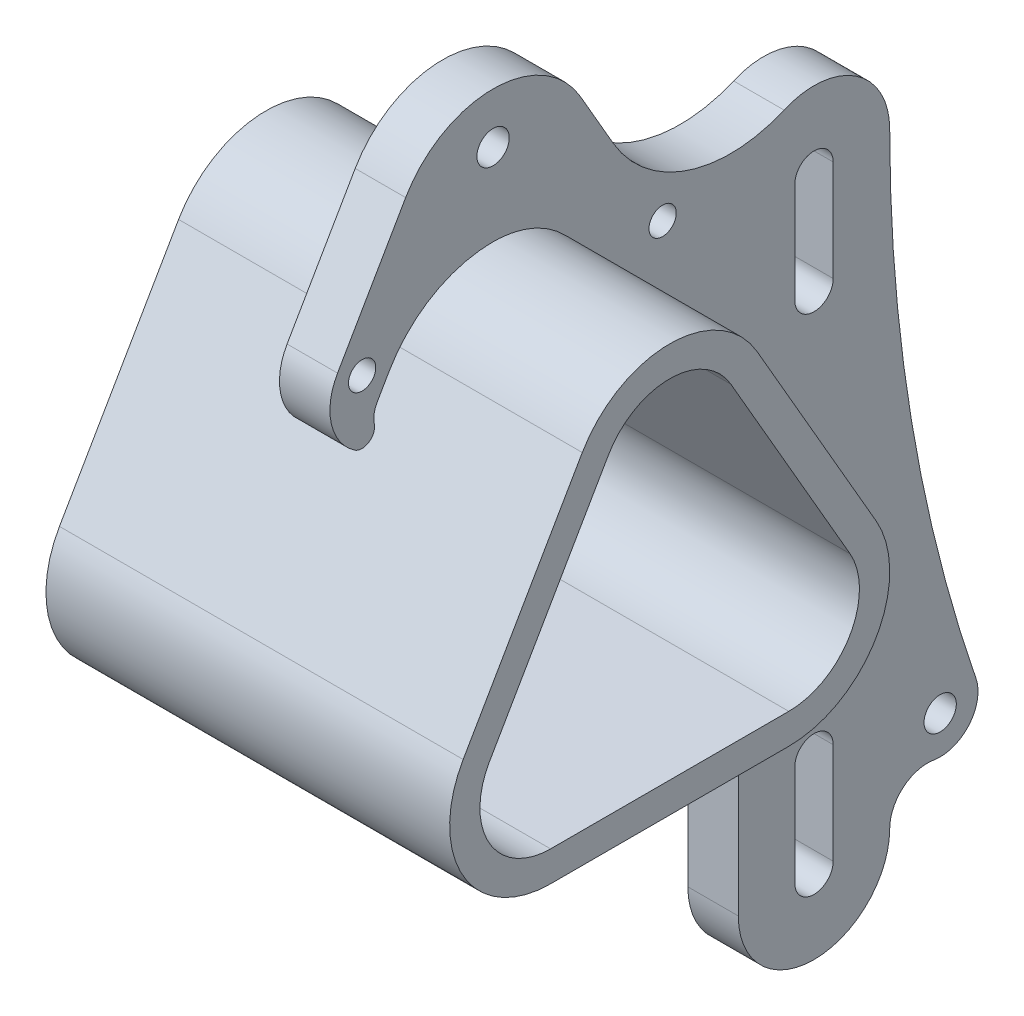
from build123d import *

# Parameters (mm, degrees)
BOSS_EXTRUDE1_DEPTH = 3.175
BOSS_EXTRUDE2_DEPTH = 25.4
SKETCH2_R           = 2.032
CUT_EXTRUDE1_DEPTH  = 129.823321873
FILLET1_R           = 3.175
SKETCH3_R           = 2.032
SKETCH3_R_2         = 1.7145
CUT_EXTRUDE2_DEPTH  = 129.823321873


with BuildPart() as part:
    # Sketch1 → Boss-Extrude1 (new, symmetric)
    with BuildSketch(Plane(origin=(0, 0, 0), x_dir=(0, 0, -1), z_dir=(1, 0, 0))):
        with BuildLine():
            Line((-9.525, 48.14489343), (-9.525, 0))
            ThreePointArc((-9.525, 0), (0, -9.525), (9.525, 0))
            ThreePointArc((9.525, 0), (11.213319469, 3.637419458), (15.08125, 4.695888328))
            ThreePointArc((15.08125, 4.695888328), (19.504344028, 6.308066524), (20.381065631, 10.933457162))
            ThreePointArc((20.381065631, 10.933457162), (12.25753337, 43.11837453), (9.525, 76.2))
            ThreePointArc((9.525, 76.2), (5.235660538, 84.156977047), (-3.769169813, 84.947513014))
            ThreePointArc((-3.769169813, 84.947513014), (-15.872465899, 84.422700464), (-25.264351554, 92.075))
            Line((-25.264351554, 92.075), (-29.38879754, 99.21875))
            ThreePointArc((-29.38879754, 99.21875), (-40.387320168, 105.56875), (-51.385842796, 99.21875))
            Line((-51.385842796, 99.21875), (-59.957040372, 84.373000316))
            ThreePointArc((-59.957040372, 84.373000316), (-60.732371985, 79.199965789), (-57.775027743, 74.885392767))
            ThreePointArc((-57.775027743, 74.885392767), (-56.529290563, 74.652888831), (-55.510288455, 75.406250566))
            ThreePointArc((-55.510288455, 75.406250566), (-55.312146583, 76.414384862), (-55.772855145, 77.332721718))
            Line((-55.772855145, 77.332721718), (-53.448065789, 81.359375))
            ThreePointArc((-53.448065789, 81.359375), (-47.927945168, 86.879495621), (-40.387320168, 88.9))
            ThreePointArc((-40.387320168, 88.9), (-34.037320168, 87.198522628), (-29.38879754, 82.55))
            Line((-29.38879754, 82.55), (-14.401477372, 56.5912))
            Line((-14.401477372, 56.5912), (-9.525, 48.14489343))
        make_face()
    extrude(amount=BOSS_EXTRUDE1_DEPTH, both=True)

    # Sketch2 → Cut-Extrude1 (cut, through all)
    with BuildSketch(Plane(origin=(3.175, 0, 0), x_dir=(0, 0, -1), z_dir=(1, 0, 0))):
        with Locations((15.875, 9.391776656)):
            Circle(SKETCH2_R)
        with BuildLine():
            Line((-2.413, 0), (-2.413, 12.7))
            ThreePointArc((-2.413, 12.7), (0, 15.113), (2.413, 12.7))
            Line((2.413, 12.7), (2.413, 0))
            ThreePointArc((2.413, 0), (0, -2.413), (-2.413, 0))
        make_face()
        with BuildLine():
            Line((2.413, 76.2), (2.413, 63.5))
            ThreePointArc((2.413, 63.5), (0, 61.087), (-2.413, 63.5))
            Line((-2.413, 63.5), (-2.413, 76.2))
            ThreePointArc((-2.413, 76.2), (0, 78.613), (2.413, 76.2))
        make_face()
    extrude(amount=-CUT_EXTRUDE1_DEPTH, mode=Mode.SUBTRACT)

    # Fillet1
    fillet1_edges = [part.edges().sort_by_distance(p)[0] for p in [
        (0, 77.332721718, 55.772855145),
    ]]
    fillet(fillet1_edges, radius=FILLET1_R)

    # Sketch3 → Cut-Extrude2 (cut, through all)
    with BuildSketch(Plane(origin=(3.175, 0, 0), x_dir=(0, 0, -1), z_dir=(1, 0, 0))):
        with Locations((-40.387320168, 99.21875)):
            Circle(SKETCH3_R)
        with Locations((-19.05, 80.517677372)):
            Circle(SKETCH3_R_2)
        with Locations((-56.863705883, 82.587062816)):
            Circle(SKETCH3_R_2)
    extrude(amount=-CUT_EXTRUDE2_DEPTH, mode=Mode.SUBTRACT)


with BuildPart() as body_2:
    # Sketch1<3> → Boss-Extrude2 (new, symmetric)
    with BuildSketch(Plane(origin=(0, 0, 0), x_dir=(0, 0, -1), z_dir=(1, 0, 0))):
        with BuildLine():
            ThreePointArc((-25.4, 37.5412), (-14.401477372, 43.8912), (-14.401477372, 56.5912))
            Line((-14.401477372, 56.5912), (-29.38879754, 82.55))
            ThreePointArc((-29.38879754, 82.55), (-34.037320168, 87.198522628), (-40.387320168, 88.9))
            ThreePointArc((-40.387320168, 88.9), (-46.737320168, 87.198522628), (-51.385842796, 82.55))
            Line((-51.385842796, 82.55), (-55.510288455, 75.406250566))
            Line((-55.510288455, 75.406250566), (-66.373162964, 56.5912))
            ThreePointArc((-66.373162964, 56.5912), (-66.373162964, 43.8912), (-55.374640336, 37.5412))
            Line((-55.374640336, 37.5412), (-25.4, 37.5412))
        make_face()
        with BuildLine():
            Line((-25.4, 41.3512), (-55.374640336, 41.3512))
            ThreePointArc((-55.374640336, 41.3512), (-63.073606175, 45.7962), (-63.073606175, 54.6862))
            Line((-63.073606175, 54.6862), (-48.086286007, 80.645))
            ThreePointArc((-48.086286007, 80.645), (-40.387320168, 85.09), (-32.688354328, 80.645))
            Line((-32.688354328, 80.645), (-17.70103416, 54.6862))
            ThreePointArc((-17.70103416, 54.6862), (-17.70103416, 45.7962), (-25.4, 41.3512))
        make_face(mode=Mode.SUBTRACT)
    extrude(amount=BOSS_EXTRUDE2_DEPTH, both=True)


solid = Compound([part.part, body_2.part])
